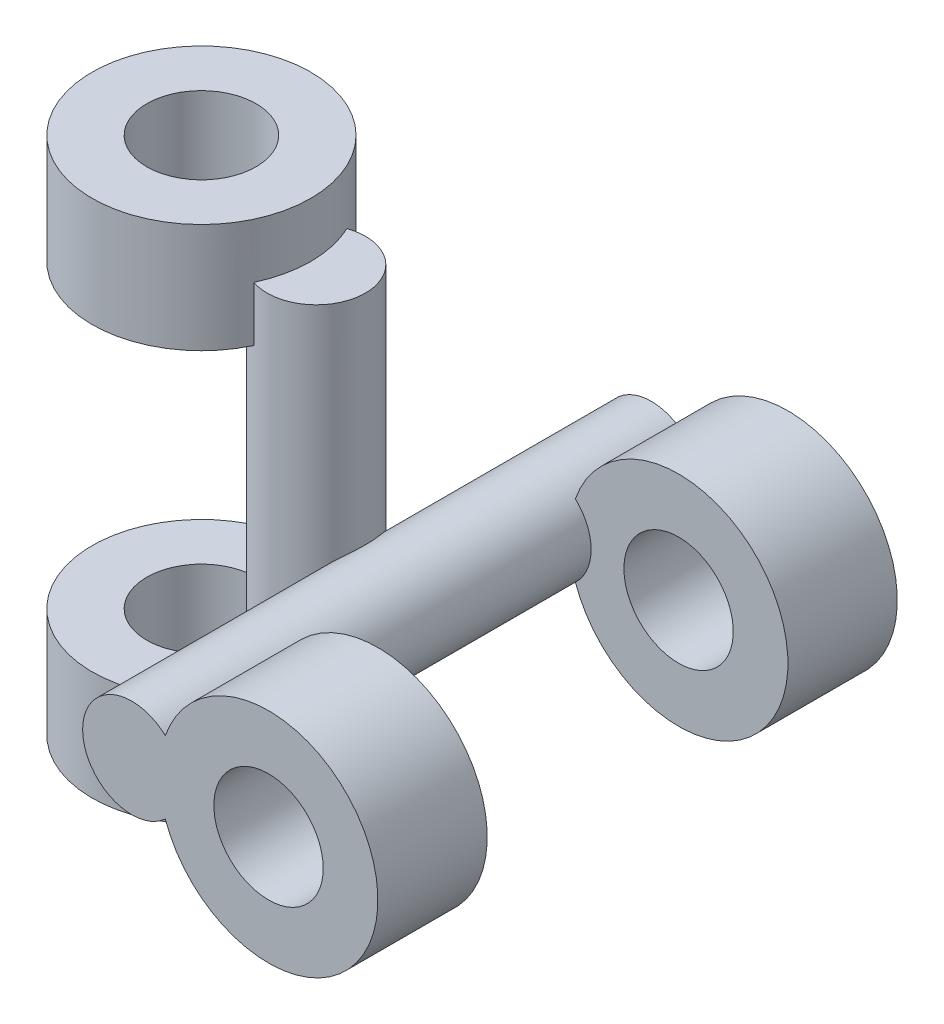
from build123d import *

# Parameters (mm, degrees)
SKETCH_1_R             = 2
SKETCH_1_R_2           = 1
EXTRUDE_1_DEPTH        = 2
EXTRUDE_1_2_DEPTH      = 7.5
EXTRUDE_1_2_DEPTH_BACK = 1
SKETCH_2_R             = 0.9
SKETCH_3_R             = 2
SKETCH_3_R_2           = 1
EXTRUDE_2_DEPTH        = 2
SKETCH_7_R             = 0.5
EXTRUDE_4_DEPTH        = 2
EXTRUDE_7_DEPTH        = 2.75
EXTRUDE_7_DEPTH_BACK   = 2.75
SKETCH_11_R            = 0.9
SKETCH_12_R            = 2
SKETCH_12_R_2          = 1
EXTRUDE_5_DEPTH        = 2
EXTRUDE_START          = 2
SKETCH_13_R            = 2
SKETCH_13_R_2          = 1
EXTRUDE_6_DEPTH        = 2
SKETCH_15_R            = 0.9
EXTRUDE_8_DEPTH        = 2
SKETCH_16_R            = 0.9
EXTRUDE_9_DEPTH        = 2


with BuildPart() as part:
    # 草图1 → Extrude 1 (new body)
    with BuildSketch(Plane(origin=(0, 0, 0), x_dir=(1, 0, 0), z_dir=(0, 1, 0))):
        Circle(SKETCH_1_R)
        Circle(SKETCH_1_R_2, mode=Mode.SUBTRACT)
    extrude(amount=EXTRUDE_1_DEPTH)

    # 草图2 → Extrude 1 2 (add, two sides: drawn at the far end of the back side and taken through both)
    with BuildSketch(Plane.XZ.offset(-EXTRUDE_1_2_DEPTH_BACK)):
        with Locations((2.1, 0)):
            Circle(SKETCH_2_R)
    extrude(amount=EXTRUDE_1_2_DEPTH + EXTRUDE_1_2_DEPTH_BACK)

    # 草图3 → 凸台-拉伸2 (add)
    with BuildSketch(Plane.XZ.offset(7.5)):
        Circle(SKETCH_3_R)
        Circle(SKETCH_3_R_2, mode=Mode.SUBTRACT)
    extrude(amount=-EXTRUDE_2_DEPTH)

    # 草图7 → 凸台-拉伸4 (add)
    with BuildSketch(Plane(origin=(1.877338573, 0, 0), x_dir=(0, 0, -1), z_dir=(1, 0, 0))):
        with Locations((0, -3.75)):
            Circle(SKETCH_7_R)
    extrude(amount=EXTRUDE_4_DEPTH)

    # 草图11 → 凸台-拉伸7 (add, two sides: drawn at the far end of the back side and taken through both)
    with BuildSketch(Plane.XY.offset(-EXTRUDE_7_DEPTH_BACK)):
        with Locations((3.477338573, -3.75)):
            Circle(SKETCH_11_R)
    extrude(amount=EXTRUDE_7_DEPTH + EXTRUDE_7_DEPTH_BACK)

    # 草图12 → 拉伸-薄壁5 (add)
    with BuildSketch(Plane.XY.offset(2.75)):
        with Locations((5.977338573, -3.75)):
            Circle(SKETCH_12_R)
        with Locations((5.977338573, -3.75)):
            Circle(SKETCH_12_R_2, mode=Mode.SUBTRACT)
    extrude(amount=EXTRUDE_5_DEPTH)

    # 草图13 → 拉伸-薄壁6 (add)
    with BuildSketch(Plane(origin=(0, 0, -2.75), x_dir=(-1, 0, 0), z_dir=(0, 0, -1)).offset(EXTRUDE_START)):
        with Locations((-5.977338573, -3.75)):
            Circle(SKETCH_13_R)
        with Locations((-5.977338573, -3.75)):
            Circle(SKETCH_13_R_2, mode=Mode.SUBTRACT)
    extrude(amount=-EXTRUDE_6_DEPTH)

    # 草图15 → 凸台-拉伸8 (add)
    with BuildSketch(Plane(origin=(0, 0, -2.75), x_dir=(-1, 0, 0), z_dir=(0, 0, -1))):
        with Locations((-3.477338573, -3.75)):
            Circle(SKETCH_15_R)
    extrude(amount=EXTRUDE_8_DEPTH)

    # 草图16 → 凸台-拉伸9 (add)
    with BuildSketch(Plane.XY.offset(2.75).offset(EXTRUDE_START)):
        with Locations((3.477338573, -3.75)):
            Circle(SKETCH_16_R)
    extrude(amount=-EXTRUDE_9_DEPTH)


solid = part.part
